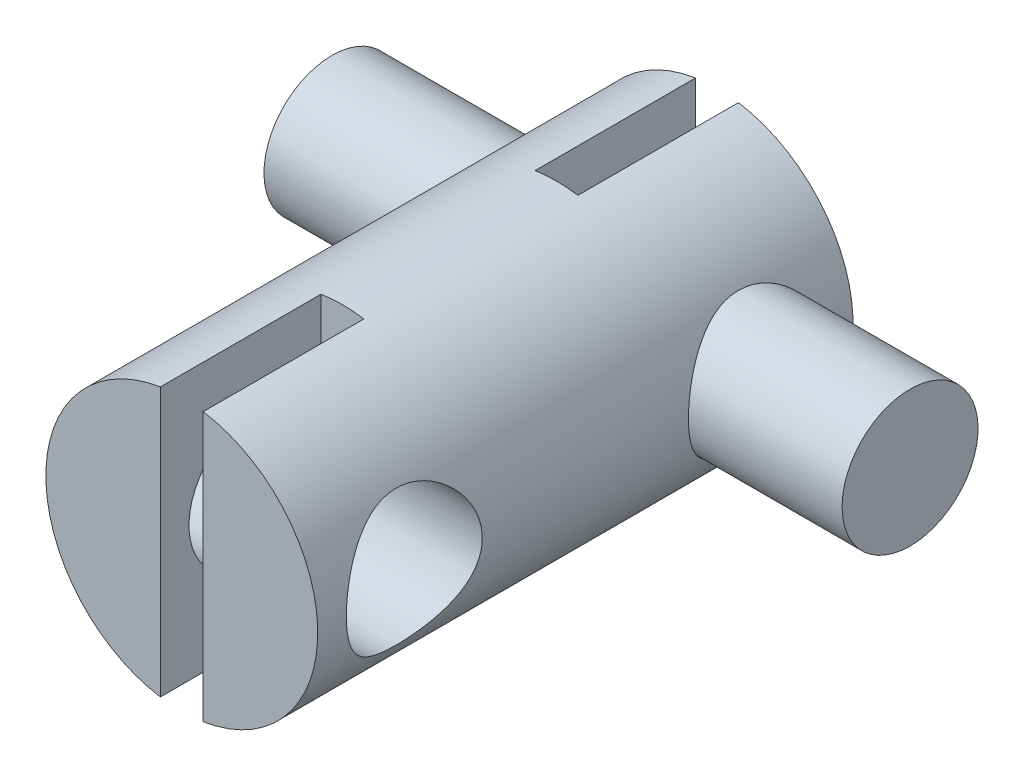
from build123d import *

# Parameters (mm, degrees)
SKETCH1_R           = 25.4
BOSS_EXTRUDE1_DEPTH = 50
SKETCH2_W           = 8
SKETCH2_H           = 56.617696499
CUT_EXTRUDE1_DEPTH  = 30
SKETCH3_R           = 12.7
CUT_EXTRUDE2_DEPTH  = 35
SKETCH4_R           = 12.7
BOSS_EXTRUDE2_DEPTH = 50
BOSS_EXTRUDE3_START = -50
SKETCH5_R           = 12.7
BOSS_EXTRUDE3_DEPTH = 50


with BuildPart() as part:
    # Sketch1 → Boss-Extrude1 (new body)
    with BuildSketch(Plane.XY):
        Circle(SKETCH1_R)
    extrude(amount=BOSS_EXTRUDE1_DEPTH)

    # Sketch2 → Cut-Extrude1 (cut)
    with BuildSketch(Plane.XY.offset(50)):
        with Locations((0, -1.452503267)):
            Rectangle(SKETCH2_W, SKETCH2_H)
    extrude(amount=-CUT_EXTRUDE1_DEPTH, mode=Mode.SUBTRACT)

    # Sketch3 → Cut-Extrude2 (cut, symmetric)
    with BuildSketch(Plane.ZY.offset(-4)):
        with Locations(Location((31.954368174, 0, 0), (0, 0, 270))):
            Circle(SKETCH3_R)
    extrude(amount=CUT_EXTRUDE2_DEPTH, both=True, mode=Mode.SUBTRACT)

    # Mirror1: part across plane


with BuildPart() as part_1:
    add(part.part)
    add(part.part.mirror(Plane.XY))

    # Sketch4 → Boss-Extrude2 (add)
    with BuildSketch(Plane.ZY.offset(-4)):
        with Locations(Location((-32.054446032, 0, 0), (0, 0, 270))):
            Circle(SKETCH4_R)
    extrude(amount=-BOSS_EXTRUDE2_DEPTH)

    # Sketch5 → Boss-Extrude3 (add)
    with BuildSketch(Plane(origin=(-4, 0, 0), x_dir=(0, 0, -1), z_dir=(1, 0, 0)).offset(BOSS_EXTRUDE3_START)):
        with Locations(Location((32.054446032, 0, 0), (0, 0, 270))):
            Circle(SKETCH5_R)
    extrude(amount=BOSS_EXTRUDE3_DEPTH)


solid = part_1.part
